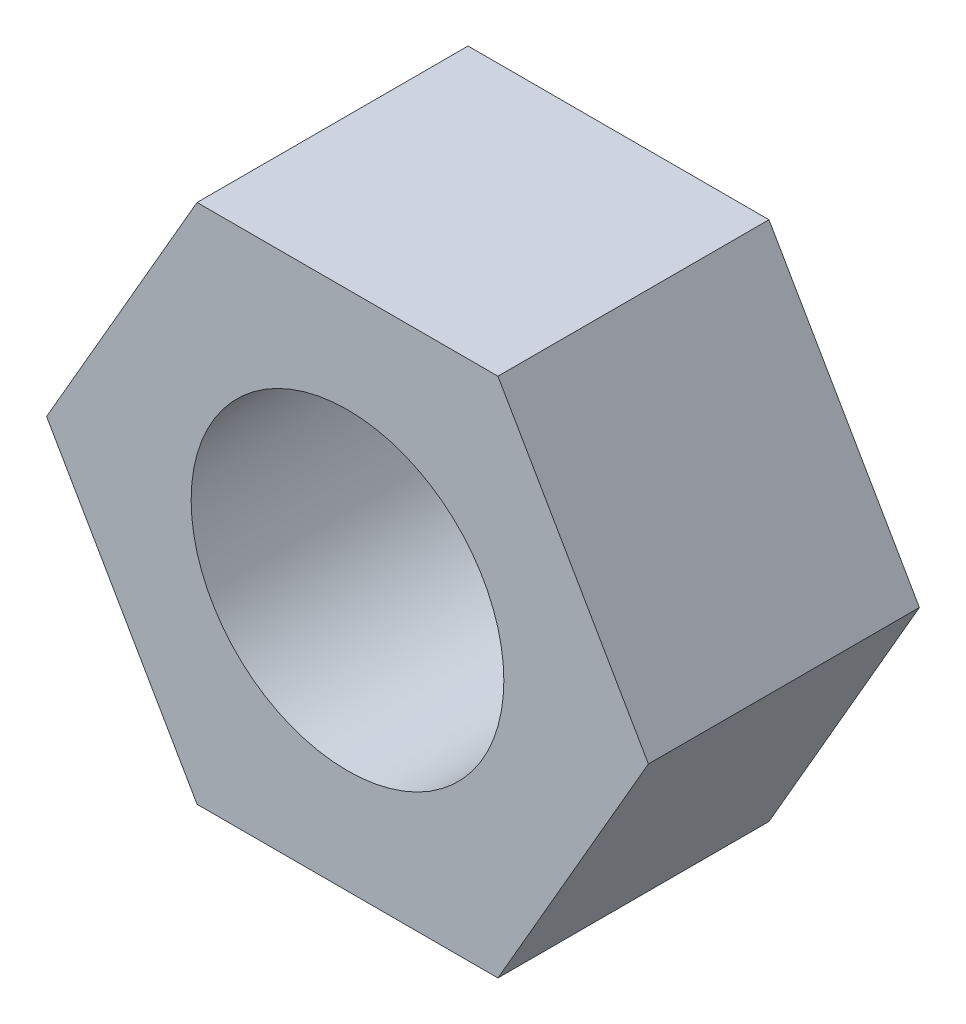
from build123d import *

# Parameters (mm, degrees)
SKETCH_1_R      = 3
EXTRUDE_1_DEPTH = 5.2


with BuildPart() as part:
    # 草图1 → 凸台-拉伸1 (new body)
    with BuildSketch(Plane.XY):
        Polygon((5.773502692, 0), (2.886751346, 5), (-2.886751346, 5), (-5.773502692, 0), (-2.886751346, -5), (2.886751346, -5), align=None)
        Circle(SKETCH_1_R, mode=Mode.SUBTRACT)
    extrude(amount=-EXTRUDE_1_DEPTH)


solid = part.part
